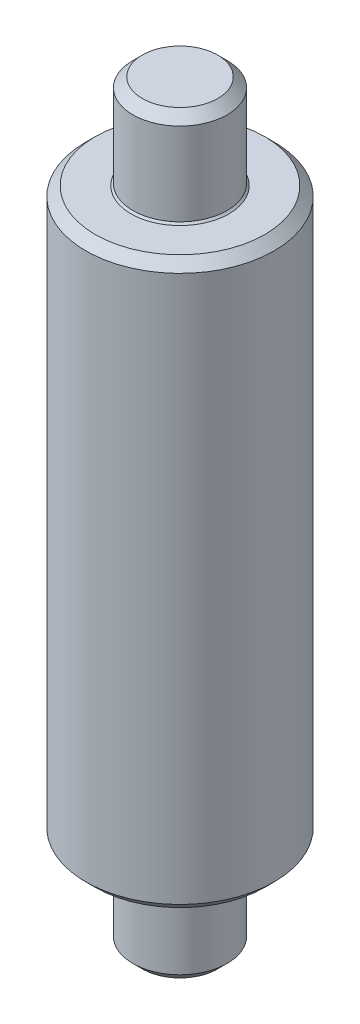
from build123d import *

# Parameters (mm, degrees)
CHAMFER_1_SIZE = 1
CHAMFER_2_SIZE = 0.2


with BuildPart() as part:
    # 草图1 → 旋转1 (revolve)
    with BuildSketch(Plane.XY, mode=Mode.PRIVATE) as revolve_1_sk:
        Polygon((0, 40), (5, 40), (5, 30), (10, 30), (10, -30), (5, -30), (5, -40), (0, -40), align=None)
    revolve(revolve_1_sk.sketch.rotate(Axis((0, 40, 0), (0, -1, 0)), 180), axis=Axis((0, 40, 0), (0, -1, 0)))

    # 倒角1
    chamfer_1_edges = [part.edges().sort_by_distance(p)[0] for p in [
        (5, -40, 0),
        (10, -30, 0),
        (10, 30, 0),
        (5, 40, 0),
    ]]
    chamfer(chamfer_1_edges, length=CHAMFER_1_SIZE)

    # 倒角2
    chamfer_2_edges = [part.edges().sort_by_distance(p)[0] for p in [
        (5, -30, 0),
        (5, 30, 0),
    ]]
    chamfer(chamfer_2_edges, length=CHAMFER_2_SIZE)


solid = part.part
